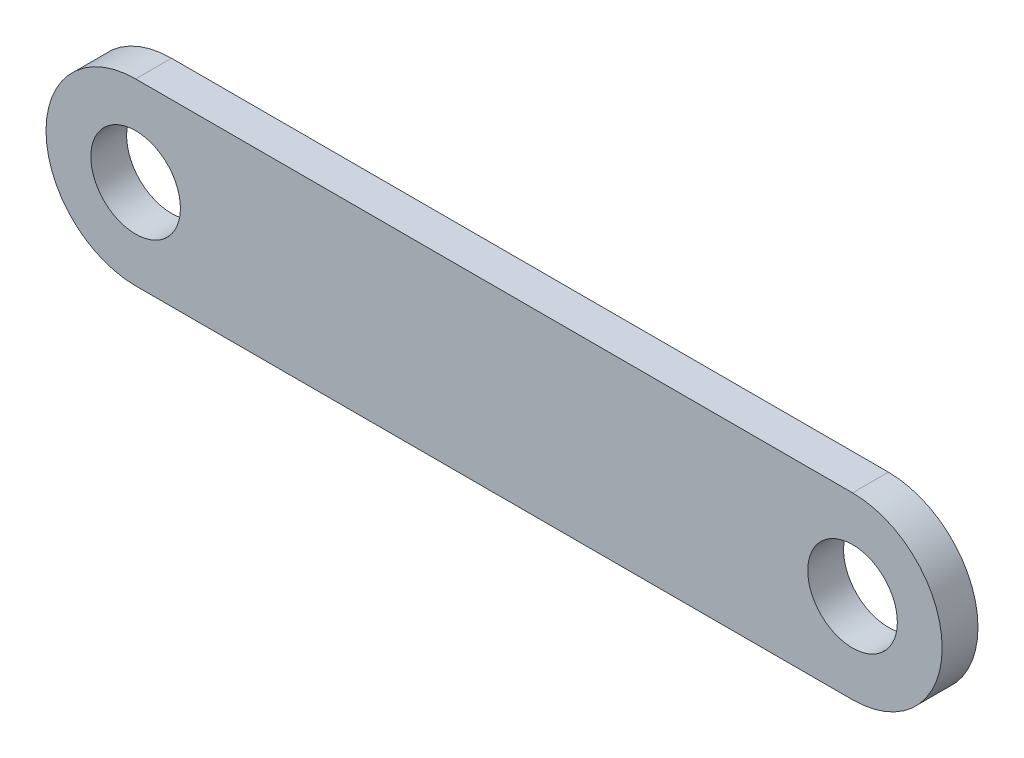
from build123d import *

# Parameters (mm, degrees)
ESQUISSE1_R        = 2.5
BOSS_EXTRU_1_DEPTH = 2


with BuildPart() as part:
    # Esquisse1 → Boss.-Extru.1 (new body)
    with BuildSketch(Plane.XY):
        with BuildLine():
            Line((-20, 5), (20, 5))
            ThreePointArc((20, 5), (25, 0), (20, -5))
            Line((20, -5), (-20, -5))
            ThreePointArc((-20, -5), (-25, 0), (-20, 5))
        make_face()
        with Locations((-20, 0)):
            Circle(ESQUISSE1_R, mode=Mode.SUBTRACT)
        with Locations((20, 0)):
            Circle(ESQUISSE1_R, mode=Mode.SUBTRACT)
    extrude(amount=BOSS_EXTRU_1_DEPTH)


solid = part.part
